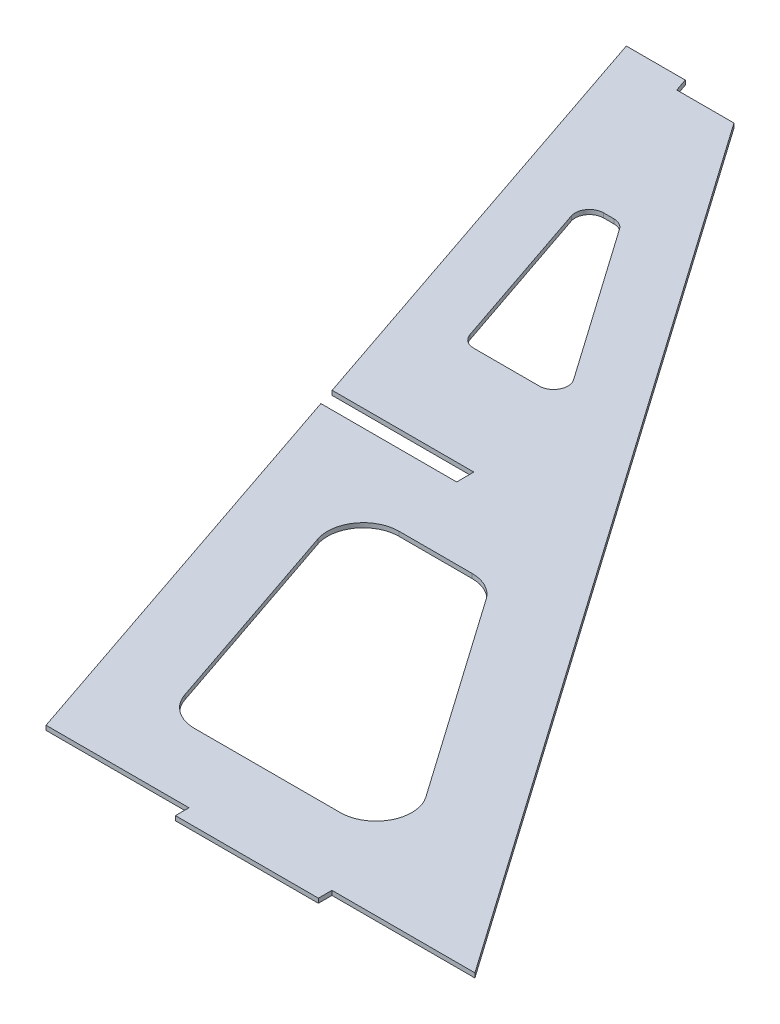
from build123d import *

# Parameters (mm, degrees)
BOSS_EXTRUDE1_DEPTH = 1.5875
CUT_EXTRUDE1_DEPTH  = 379.865331816
CUT_EXTRUDE2_DEPTH  = 379.865331816
FILLET1_R           = 12.7
FILLET2_R           = 5.08


with BuildPart() as part:
    # Sketch1 → Boss-Extrude1 (new body)
    with BuildSketch(Plane(origin=(0, 0, 0), x_dir=(1, 0, 0), z_dir=(0, 1, 0))):
        Polygon((-207.536668491, 316.962065124), (-186.581668491, 316.962065124), (-185.030654327, 312.392094548), (-164.710654327, 312.392094548), (50.8, 4.826), (0, 4.826), (0, 0), (-50.8, 0), (-50.8, 4.826), (-101.6, 4.826), align=None)
    extrude(amount=BOSS_EXTRUDE1_DEPTH)

    # Sketch2 → Cut-Extrude1 (cut, through all)
    with BuildSketch(Plane(origin=(0, 1.5875, 0), x_dir=(1, 0, 0), z_dir=(0, 1, 0))):
        Polygon((-103.511728228, 158.75), (-103.511728228, 152.654), (-151.771728228, 152.654), (-153.840665475, 158.75), align=None)
    extrude(amount=-CUT_EXTRUDE1_DEPTH, mode=Mode.SUBTRACT)

    # Sketch3 → Cut-Extrude2 (cut, through all)
    with BuildSketch(Plane(origin=(0, 1.5875, 0), x_dir=(1, 0, 0), z_dir=(0, 1, 0))):
        Polygon((-116.328139028, 127.254), (-83.397554521, 30.226), (1.987487188, 30.226), (-65.999745926, 127.254), align=None)
        Polygon((-167.286096734, 261.592094548), (-145.313109394, 196.85), (-108.562496075, 196.85), (-153.927090567, 261.592094548), align=None)
    extrude(amount=-CUT_EXTRUDE2_DEPTH, mode=Mode.SUBTRACT)

    # Fillet1
    fillet1_edges = [part.edges().sort_by_distance(p)[0] for p in [
        (-116.328139028, 0.79375, -127.254),
        (-65.999745926, 0.79375, -127.254),
        (1.987487188, 0.79375, -30.226),
        (-83.397554521, 0.79375, -30.226),
    ]]
    fillet(fillet1_edges, radius=FILLET1_R)

    # Fillet2
    fillet2_edges = [part.edges().sort_by_distance(p)[0] for p in [
        (-167.286096734, 0.79375, -261.592094548),
        (-153.927090567, 0.79375, -261.592094548),
        (-108.562496075, 0.79375, -196.85),
        (-145.313109394, 0.79375, -196.85),
    ]]
    fillet(fillet2_edges, radius=FILLET2_R)


solid = part.part
